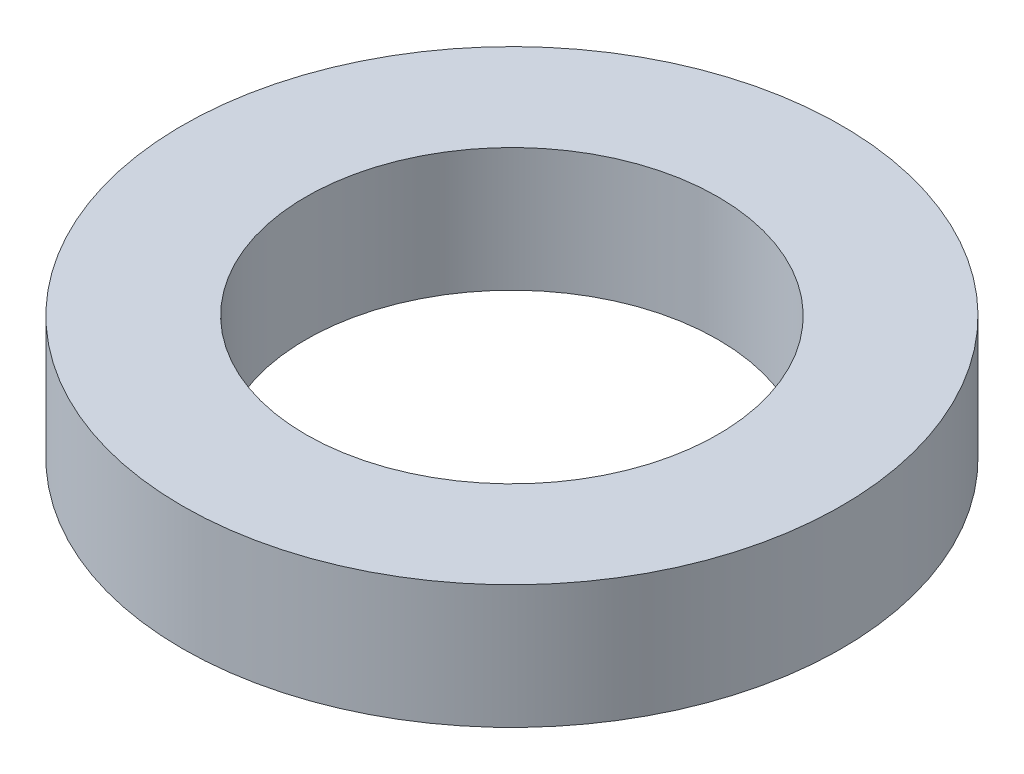
from build123d import *

# Parameters (mm, degrees)
SKETCH1_R           = 8
SKETCH1_R_2         = 5
BOSS_EXTRUDE1_DEPTH = 3


with BuildPart() as part:
    # Sketch1 → Boss-Extrude1 (new body)
    with BuildSketch(Plane(origin=(0, 0, 0), x_dir=(1, 0, 0), z_dir=(0, 1, 0))):
        with Locations(Location((0, 0, 0), (0, 0, 270))):
            Circle(SKETCH1_R)
        with Locations(Location((0, 0, 0), (0, 0, 270))):
            Circle(SKETCH1_R_2, mode=Mode.SUBTRACT)
    extrude(amount=BOSS_EXTRUDE1_DEPTH)


solid = part.part
